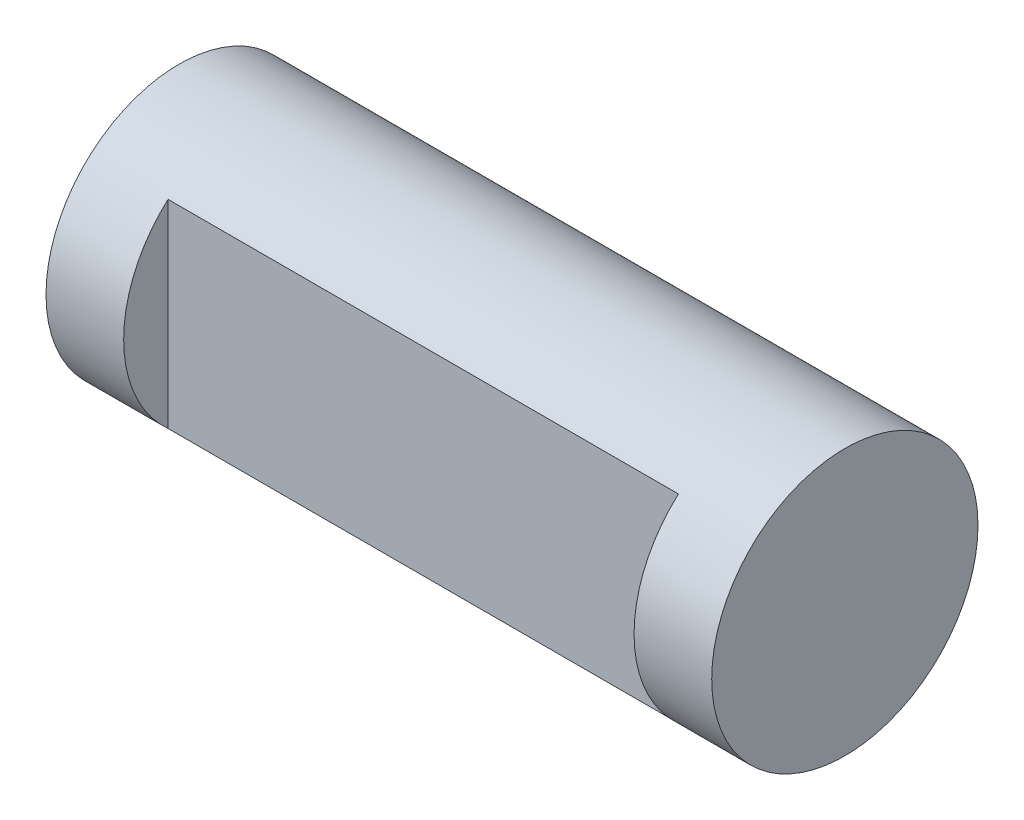
from build123d import *

# Parameters (mm, degrees)
SKETCH_1_W               = 60
SKETCH_1_H               = 12
CUT_EXTRUDE_2_DEPTH      = 23
CUT_EXTRUDE_2_DEPTH_BACK = 23


with BuildPart() as part:
    # Эскиз1 → Повернуть1 (revolve)
    with BuildSketch(Plane.XY, mode=Mode.PRIVATE) as revolve_1_sk:
        with Locations((30, 6)):
            Rectangle(SKETCH_1_W, SKETCH_1_H)
    revolve(revolve_1_sk.sketch.rotate(Axis((0, 0, 0), (1, 0, 0)), 90), axis=Axis((0, 0, 0), (1, 0, 0)))

    # Эскиз2 → Вырез-Вытянуть2 (cut, two sides: drawn at the far end of the back side and taken through both)
    with BuildSketch(Plane.ZY.offset(-30).offset(-CUT_EXTRUDE_2_DEPTH_BACK)):
        Polygon((8, 76.863613268), (8, 8.94427191), (8, -8.94427191), (8, -76.863613268), (143.838682716, -76.863613268), (143.838682716, 76.863613268), align=None)
    extrude(amount=CUT_EXTRUDE_2_DEPTH + CUT_EXTRUDE_2_DEPTH_BACK, mode=Mode.SUBTRACT)


solid = part.part
